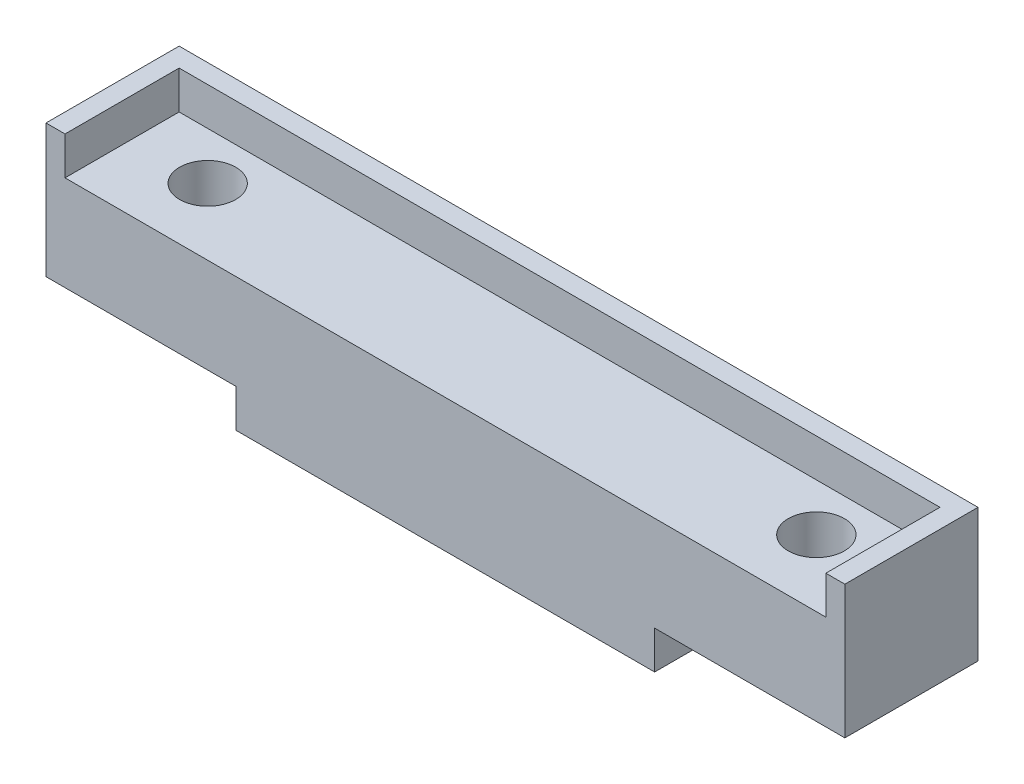
from build123d import *

# Parameters (mm, degrees)
SKETCH1_W            = 42
SKETCH1_H            = 7
RISER_DEPTH          = 7
SKETCH2_R            = 1.475
MOUNTING_HOLES_DEPTH = 44.150898021
SKETCH4_W            = 40
SKETCH4_H            = 6
RECESS_3_SIDES_DEPTH = 2
SKETCH5_W            = 22
SKETCH5_H            = 7
ALIGNMENT_TAB_DEPTH  = 2


with BuildPart() as part:
    # Sketch1 → Riser (new body)
    with BuildSketch(Plane(origin=(0, 0, 0), x_dir=(1, 0, 0), z_dir=(0, 1, 0))):
        with Locations((21, 3.5)):
            Rectangle(SKETCH1_W, SKETCH1_H)
    extrude(amount=RISER_DEPTH)

    # Sketch2 → Mounting Holes (cut, through all)
    with BuildSketch(Plane.XZ):
        with Locations(Location((5, -3.5, 0), (0, 0, 270))):
            Circle(SKETCH2_R)
        with Locations(Location((37, -3.5, 0), (0, 0, 90))):
            Circle(SKETCH2_R)
    extrude(amount=-MOUNTING_HOLES_DEPTH, mode=Mode.SUBTRACT)

    # Sketch4 → Recess (3-Sides) (cut)
    with BuildSketch(Plane(origin=(0, 7, 0), x_dir=(1, 0, 0), z_dir=(0, 1, 0))):
        with Locations((21, 3)):
            Rectangle(SKETCH4_W, SKETCH4_H)
    extrude(amount=-RECESS_3_SIDES_DEPTH, mode=Mode.SUBTRACT)

    # Sketch5 → Alignment Tab (add)
    with BuildSketch(Plane.XZ):
        with Locations((21, -3.5)):
            Rectangle(SKETCH5_W, SKETCH5_H)
    extrude(amount=ALIGNMENT_TAB_DEPTH)


solid = part.part
